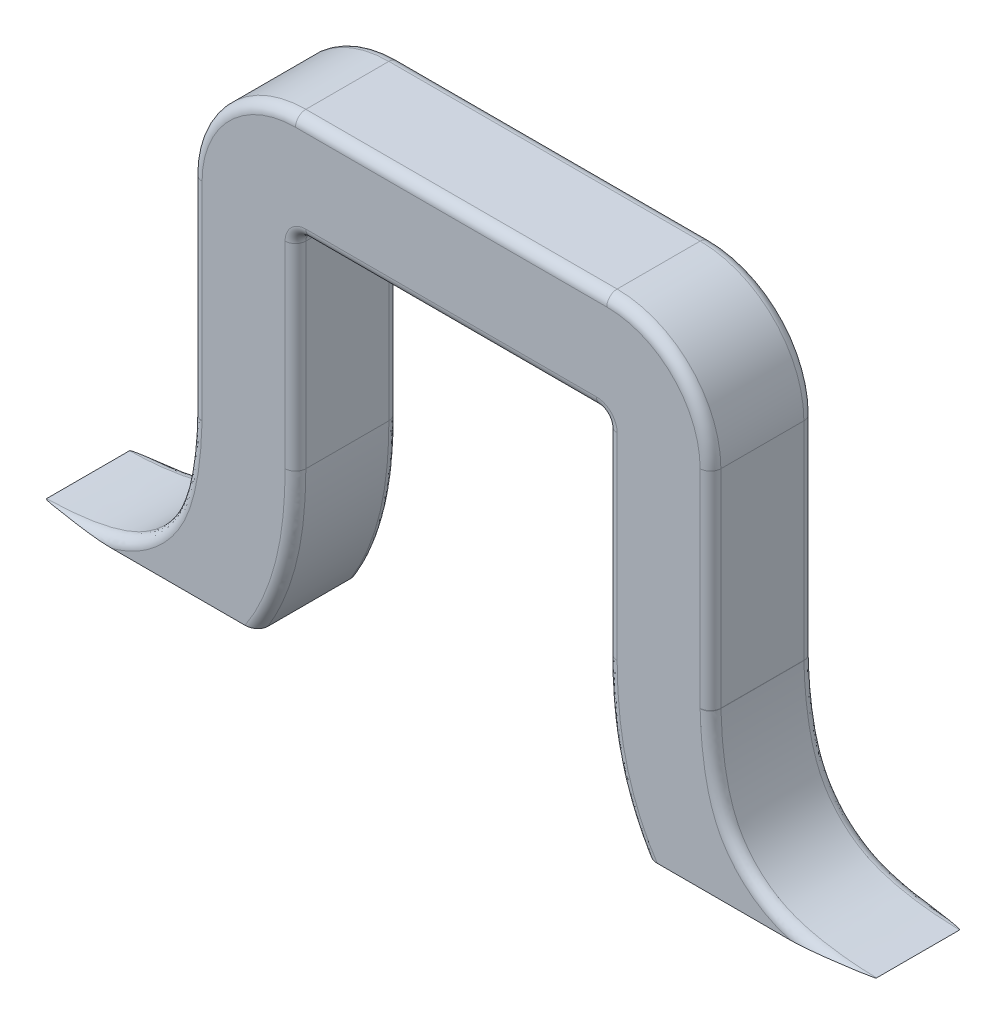
from build123d import *

# Parameters (mm, degrees)
BOSS_EXTRUDE1_DEPTH = 1
FILLET1_R           = 1
FILLET2_R           = 0.1


with BuildPart() as part:
    # Sketch1 → Boss-Extrude1 (new body)
    with BuildSketch(Plane.XY):
        with BuildLine():
            Line((-4, -1.5), (-1.86713023, -1.5))
            add(Edge.make_bspline(
                [(-1.5, 0), (-1.5, -0.239843574), (-1.576697291, -0.910708483), (-1.797746749, -1.384676511), (-1.859737495, -1.488054778), (-1.86713023, -1.5)],
                knots=[0, 0, 0, 0.106597144, 0.319791432, 0.375, 0.382291432, 0.382291432, 0.382291432], degree=2))
            Line((-1.5, 0), (-1.5, 2))
            Line((-1.5, 2), (1.5, 2))
            Line((1.5, 2), (1.5, 0))
            add(Edge.make_bspline(
                [(1.86713023, -1.5), (1.859737495, -1.488054778), (1.797746749, -1.384676511), (1.576697291, -0.910708483), (1.5, -0.239843574), (1.5, 0)],
                knots=[0.617708568, 0.617708568, 0.617708568, 0.625, 0.680208568, 0.893402856, 1, 1, 1], degree=2))
            Line((1.86713023, -1.5), (4, -1.5))
            add(Edge.make_bspline(
                [(4, -1.5), (3.347609204, -1.483453315), (2.833922252, -1.166077748), (2.516546685, -0.652390796), (2.5, 0)],
                knots=[0, 0, 0, 0.375, 0.625, 1, 1, 1], degree=2))
            Line((2.5, 0), (2.5, 3))
            Line((2.5, 3), (-2.5, 3))
            Line((-2.5, 3), (-2.5, 0))
            add(Edge.make_bspline(
                [(-2.5, 0), (-2.516546685, -0.652390796), (-2.833922252, -1.166077748), (-3.347609204, -1.483453315), (-4, -1.5)],
                knots=[0, 0, 0, 0.375, 0.625, 1, 1, 1], degree=2))
        make_face()
    extrude(amount=BOSS_EXTRUDE1_DEPTH)

    # Fillet1
    fillet1_edges = [part.edges().sort_by_distance(p)[0] for p in [
        (-2.5, 3, 0.5),
        (2.5, 3, 0.5),
    ]]
    fillet(fillet1_edges, radius=FILLET1_R)

    # Fillet2
    fillet2_edges = [part.edges().sort_by_distance(p)[0] for p in [
        (-1.578591195, -0.776669613, 1),
        (-2.853553391, -1.146446609, 0),
        (-2.5, 1, 0),
        (2.853553391, -1.146446609, 0),
        (-1.5, 1, 1),
        (1.578591195, -0.776669613, 0),
        (1.5, 1, 0),
        (0, 2, 0),
        (-1.5, 1, 0),
        (-1.578591195, -0.776669613, 0),
        (0, 2, 1),
        (-2.5, 0, 0.5),
        (2.5, 0, 0.5),
        (1.5, 2, 0.5),
        (-1.5, 2, 0.5),
        (1.5, 1, 1),
        (1.578591195, -0.776669613, 1),
        (0, 3, 0),
        (0, 3, 1),
        (2.5, 1, 0),
        (-2.207106781, 2.707106781, 0),
        (2.207106781, 2.707106781, 0),
        (2.853553391, -1.146446609, 1),
        (2.5, 1, 1),
        (-2.207106781, 2.707106781, 1),
        (2.207106781, 2.707106781, 1),
        (-2.5, 1, 1),
        (-2.853553391, -1.146446609, 1),
    ]]
    fillet(fillet2_edges, radius=FILLET2_R)


solid = part.part
